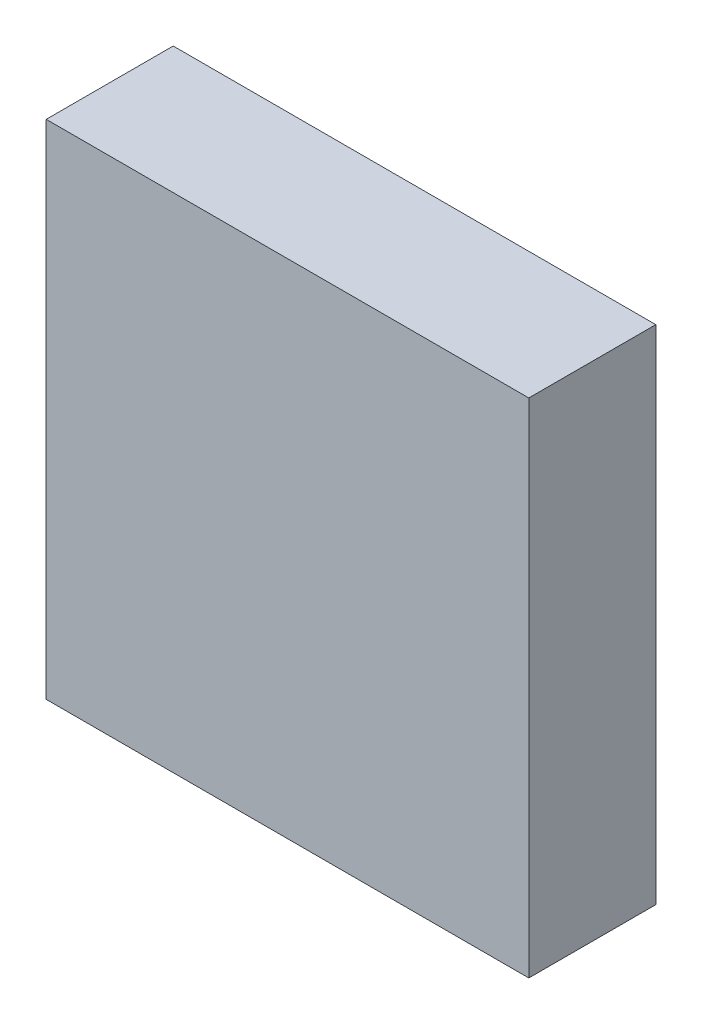
from build123d import *

# Parameters (mm, degrees)
SKETCH_1_W      = 1710
SKETCH_1_H      = 450
EXTRUDE_1_DEPTH = 1780


with BuildPart() as part:
    # ｽｹｯﾁ1 → ﾎﾞｽ - 押し出し1 (new body)
    with BuildSketch(Plane(origin=(0, 0, 0), x_dir=(1, 0, 0), z_dir=(0, 1, 0))):
        with Locations((855, 225)):
            Rectangle(SKETCH_1_W, SKETCH_1_H)
    extrude(amount=EXTRUDE_1_DEPTH)


solid = part.part
